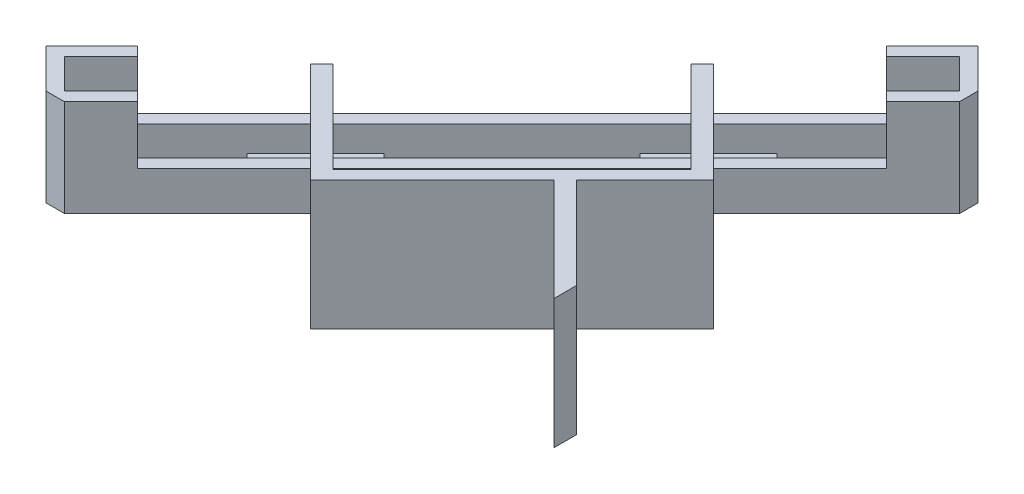
from build123d import *

# Parameters (mm, degrees)
BOSS_EXTRUDE1_DEPTH = 25.4
BOSS_EXTRUDE2_DEPTH = 8.255
SKETCH3_W           = 129.54
SKETCH3_H           = 19.05
BOSS_EXTRUDE3_DEPTH = 2.54
SKETCH5_R           = 3.429
SKETCH5_R_2         = 3.556
SKETCH5_R_3         = 2.032
CUT_EXTRUDE1_DEPTH  = 157.634048422
CUT_EXTRUDE2_DEPTH  = 143.615119202
CUT_EXTRUDE3_DEPTH  = 13.335
BOSS_EXTRUDE4_DEPTH = 3.174993
BOSS_EXTRUDE5_DEPTH = 3.175001


with BuildPart() as part:
    # Sketch1 → Boss-Extrude1 (new body)
    with BuildSketch(Plane(origin=(0, 0, 0), x_dir=(1, 0, 0), z_dir=(0, 1, 0))):
        Polygon((-91.598612435, 0), (0, 0), (0, 91.598612435), align=None)
    extrude(amount=BOSS_EXTRUDE1_DEPTH)

    # Sketch2 → Boss-Extrude2 (add)
    with BuildSketch(Plane(origin=(-45.799306217, 0, -45.799306217), x_dir=(-0.7071067811865476, 0, 0.7071067811865475), z_dir=(-0.7071067811865475, 0, -0.7071067811865476))):
        Polygon((-64.77, 19.05), (-62.23, 19.05), (-62.23, 2.54), (62.23, 2.54), (62.23, 19.05), (64.77, 19.05), (64.77, 0), (-64.77, 0), align=None)
    extrude(amount=BOSS_EXTRUDE2_DEPTH)

    # Sketch3 → Boss-Extrude3 (add)
    with BuildSketch(Plane(origin=(-51.636472696, 0, -51.636472696), x_dir=(-0.7071067811865476, 0, 0.7071067811865475), z_dir=(-0.7071067811865475, 0, -0.7071067811865476))):
        with Locations((0, 9.525)):
            Rectangle(SKETCH3_W, SKETCH3_H)
    extrude(amount=BOSS_EXTRUDE3_DEPTH)

    # Sketch5 → Cut-Extrude1 (cut, through all)
    with BuildSketch(Plane(origin=(45.799306217, 0, -45.799306217), x_dir=(-0.7071067811865475, 0, -0.7071067811865476), z_dir=(0.7071067811865476, 0, -0.7071067811865475))):
        with Locations((20.32, 12.7)):
            Circle(SKETCH5_R)
        with Locations((45.72, 12.7)):
            Circle(SKETCH5_R_2)
        with Locations((-5.08, 12.7)):
            Circle(SKETCH5_R_2)
        with Locations((20.32, 22.3266)):
            Circle(SKETCH5_R_3)
        with Locations((11.983119848, 7.8867)):
            Circle(SKETCH5_R_3)
        with Locations((28.656880152, 7.8867)):
            Circle(SKETCH5_R_3)
    extrude(amount=-CUT_EXTRUDE1_DEPTH, mode=Mode.SUBTRACT)

    # Sketch6 → Cut-Extrude2 (cut, through all)
    with BuildSketch(Plane(origin=(0, 25.4, 0), x_dir=(1, 0, 0), z_dir=(0, 1, 0))):
        Polygon((-95.639727689, 7.633217703), (-89.802561211, 1.796051224), (-71.842048969, 19.756563466), (-77.679215447, 25.593729945), align=None)
        Polygon((-88.006509986, 0), (-48.621024484, 0), (-44.130896424, 4.490128061), (-63.823639175, 24.182870812), align=None)
        Polygon((-43.681883618, 8.531243315), (-61.578575145, 26.427934842), (-26.427934842, 61.578575145), (-8.531243315, 43.681883618), align=None)
        Polygon((-64.208831266, 39.064114127), (-58.371664787, 33.226947648), (-33.226947648, 58.371664787), (-39.064114127, 64.208831266), align=None)
        Polygon((-19.756563466, 71.842048969), (-1.796051224, 89.802561211), (-7.633217703, 95.639727689), (-25.593729945, 77.679215447), align=None)
        Polygon((-17.960512242, 30.660512242), (0, 12.7), (0, 48.621024484), (-4.490128061, 44.130896424), align=None)
        Polygon((0, 0), (0, 8.209871939), (-2.24506403, 10.45493597), (-20.205576272, 28.415448212), (-44.130896424, 4.490128061), (-48.621024484, 0), align=None)
        Polygon((-4.490128061, 44.130896424), (0, 48.621024484), (0, 88.006509986), (-24.182870812, 63.823639175), align=None)
    extrude(amount=-CUT_EXTRUDE2_DEPTH, mode=Mode.SUBTRACT)

    # Sketch7 → Cut-Extrude3 (cut)
    with BuildSketch(Plane(origin=(-53.43252392, 0, -53.43252392), x_dir=(-0.7071067811865476, 0, 0.7071067811865476), z_dir=(-0.7071067811865476, 0, -0.7071067811865476))):
        Polygon((-64.77, 25.4), (-64.77, 19.05), (-52.07, 19.05), (-52.07, 7.62), (52.07, 7.62), (52.07, 19.05), (64.77, 19.05), (64.77, 25.4), align=None)
    extrude(amount=-CUT_EXTRUDE3_DEPTH, mode=Mode.SUBTRACT)

    # Sketch8 → Boss-Extrude4 (add)
    with BuildSketch(Plane(origin=(-19.820384182, 0, 19.820384182), x_dir=(0.707106781186548, 0, 0.7071067811865471), z_dir=(-0.7071067811865471, 0, 0.707106781186548))):
        Polygon((-62.23, 25.4), (-62.23, 7.62), (-64.77, 7.62), align=None)
    extrude(amount=-BOSS_EXTRUDE4_DEPTH)

    # Sketch9 → Boss-Extrude5 (add)
    with BuildSketch(Plane(origin=(17.575320151, 0, -17.575320151), x_dir=(0.7071067811865477, 0, 0.7071067811865475), z_dir=(-0.7071067811865475, 0, 0.7071067811865477))):
        Polygon((-62.23, 25.4), (-62.23, 7.62), (-64.77, 7.62), align=None)
    extrude(amount=-BOSS_EXTRUDE5_DEPTH)


solid = part.part
